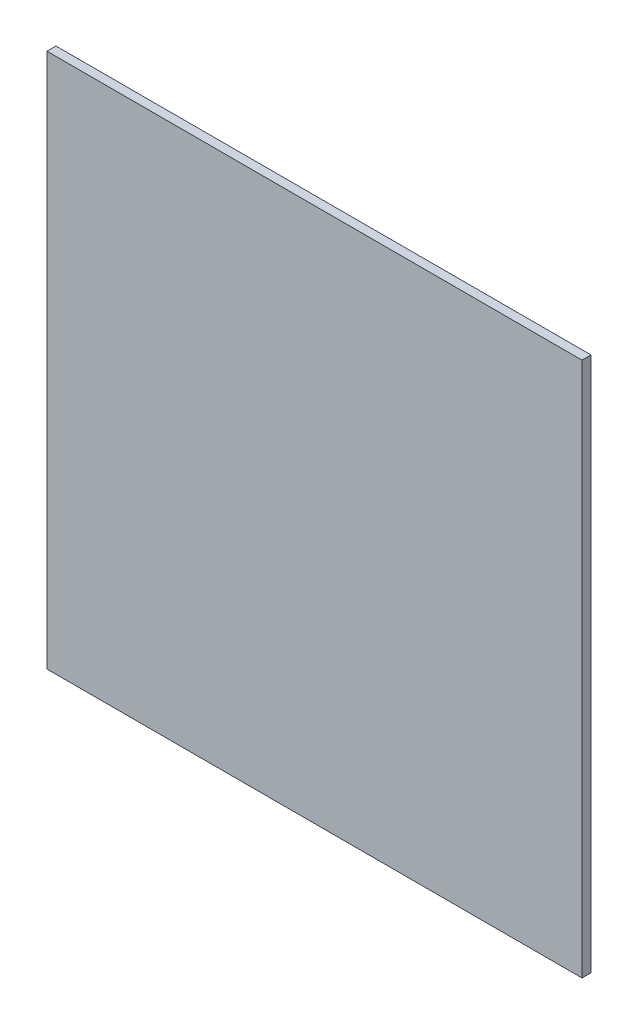
from build123d import *

# Parameters (mm, degrees)
SKETCH_1_W      = 95.25
SKETCH_1_H      = 95.25
EXTRUDE_1_DEPTH = 1.6


with BuildPart() as part:
    # 草图1 → 凸台-拉伸1 (new body)
    with BuildSketch(Plane.XY):
        Rectangle(SKETCH_1_W, SKETCH_1_H)
    extrude(amount=EXTRUDE_1_DEPTH)


solid = part.part
